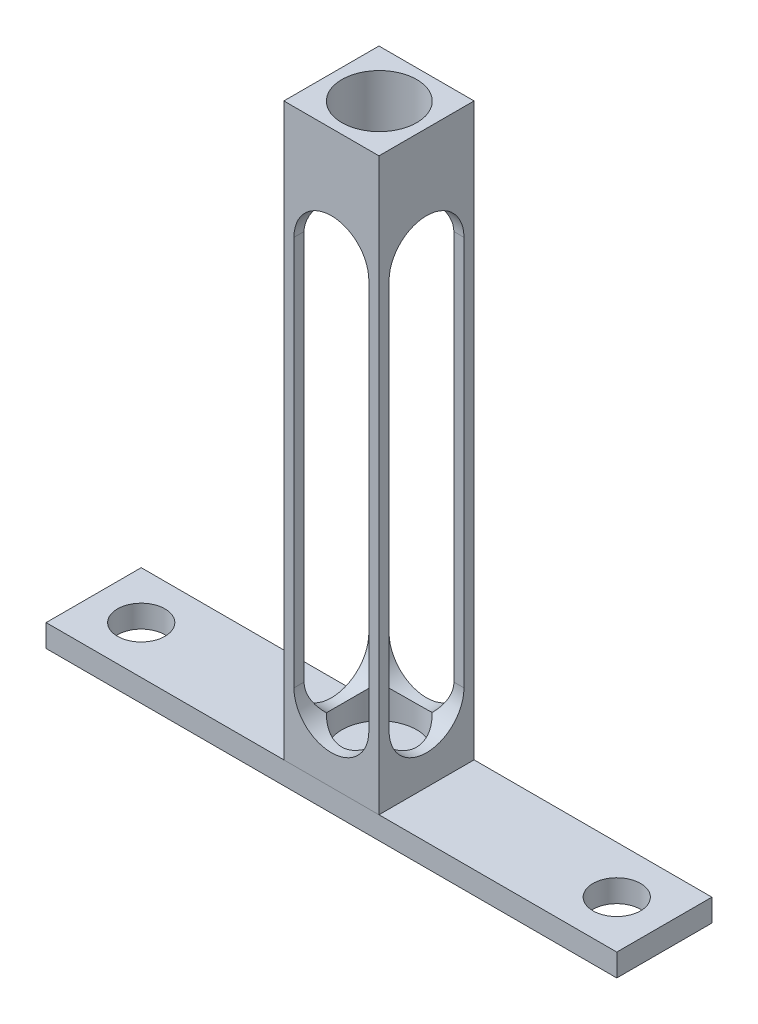
from build123d import *

# Parameters (mm, degrees)
SKETCH1_W           = 12.7
SKETCH1_H           = 76.2
BOSS_EXTRUDE1_DEPTH = 12.7
SKETCH4_W           = 76.2
SKETCH4_H           = 12.7
BOSS_EXTRUDE3_DEPTH = 3
CUT_EXTRUDE5_DEPTH  = 12.7
CUT_EXTRUDE6_DEPTH  = 12.7
SKETCH16_R          = 5
CUT_EXTRUDE8_DEPTH  = 75.2
SKETCH17_R          = 3.175
CUT_EXTRUDE9_DEPTH  = 3
SKETCH18_R          = 3.175
CUT_EXTRUDE10_DEPTH = 3


with BuildPart() as part:
    # Sketch1 → Boss-Extrude1 (new body)
    with BuildSketch(Plane.XY):
        with Locations((6.35, 38.1)):
            Rectangle(SKETCH1_W, SKETCH1_H)
    extrude(amount=BOSS_EXTRUDE1_DEPTH)

    # Sketch4 → Boss-Extrude3 (add)
    with BuildSketch(Plane(origin=(0, 0, 0), x_dir=(-1, 0, 0), z_dir=(0, -1, 0))):
        with Locations((-6.351309366, -6.3465887)):
            Rectangle(SKETCH4_W, SKETCH4_H)
    extrude(amount=BOSS_EXTRUDE3_DEPTH)

    # Sketch12 → Cut-Extrude5 (cut)
    with BuildSketch(Plane.XY.offset(12.7)):
        with BuildLine():
            Line((1.35, 9), (1.35, 61.1))
            ThreePointArc((1.35, 61.1), (6.35, 66.1), (11.35, 61.1))
            Line((11.35, 61.1), (11.35, 9))
            ThreePointArc((11.35, 9), (6.35, 4), (1.35, 9))
        make_face()
    extrude(amount=-CUT_EXTRUDE5_DEPTH, mode=Mode.SUBTRACT)

    # Sketch13 → Cut-Extrude6 (cut)
    with BuildSketch(Plane(origin=(12.7, 0, 0), x_dir=(0, 0, -1), z_dir=(1, 0, 0))):
        with BuildLine():
            Line((-11.35, 9), (-11.35, 61.1))
            ThreePointArc((-11.35, 61.1), (-6.35, 66.1), (-1.35, 61.1))
            Line((-1.35, 61.1), (-1.35, 9))
            ThreePointArc((-1.35, 9), (-6.35, 4), (-11.35, 9))
        make_face()
    extrude(amount=-CUT_EXTRUDE6_DEPTH, mode=Mode.SUBTRACT)

    # Sketch16 → Cut-Extrude8 (cut)
    with BuildSketch(Plane(origin=(0, 76.2, 0), x_dir=(1, 0, 0), z_dir=(0, 1, 0))):
        with Locations(Location((6.394331047, -6.34829435, 0), (0, 0, 270))):
            Circle(SKETCH16_R)
    extrude(amount=-CUT_EXTRUDE8_DEPTH, mode=Mode.SUBTRACT)

    # Sketch17 → Cut-Extrude9 (cut)
    with BuildSketch(Plane(origin=(0, 0, 0), x_dir=(1, 0, 0), z_dir=(0, 1, 0))):
        with Locations(Location((-25.398690634, -6.3465887, 0), (0, 0, 270))):
            Circle(SKETCH17_R)
    extrude(amount=-CUT_EXTRUDE9_DEPTH, mode=Mode.SUBTRACT)

    # Sketch18 → Cut-Extrude10 (cut)
    with BuildSketch(Plane(origin=(0, 0, 0), x_dir=(1, 0, 0), z_dir=(0, 1, 0))):
        with Locations(Location((38.1, -6.3465887, 0), (0, 0, 270))):
            Circle(SKETCH18_R)
    extrude(amount=-CUT_EXTRUDE10_DEPTH, mode=Mode.SUBTRACT)


solid = part.part
